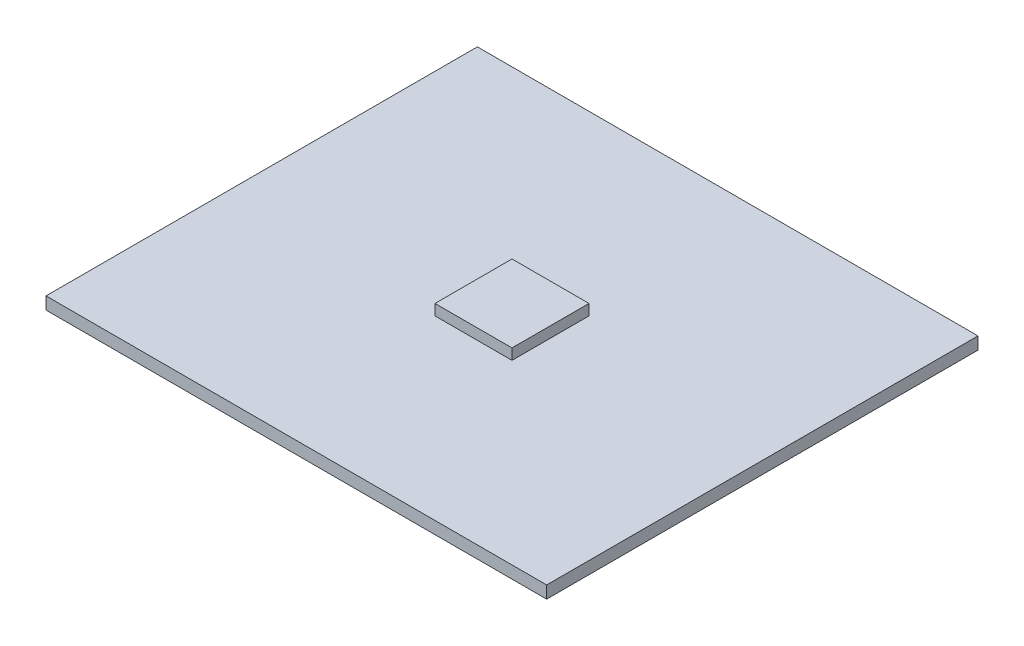
from build123d import *

# Parameters (mm, degrees)
SKETCH1_W           = 65
SKETCH1_H           = 56
BOSS_EXTRUDE1_DEPTH = 1.6
SKETCH2_W           = 10
SKETCH2_H           = 10
BOSS_EXTRUDE2_DEPTH = 3


with BuildPart() as part:
    # Sketch1 → Boss-Extrude1 (new body)
    with BuildSketch(Plane(origin=(0, 0, 0), x_dir=(1, 0, 0), z_dir=(0, 1, 0))):
        Rectangle(SKETCH1_W, SKETCH1_H)
    extrude(amount=BOSS_EXTRUDE1_DEPTH)

    # Sketch2 → Boss-Extrude2 (add)
    with BuildSketch(Plane(origin=(0, 0, 0), x_dir=(1, 0, 0), z_dir=(0, 1, 0))):
        Rectangle(SKETCH2_W, SKETCH2_H)
    extrude(amount=BOSS_EXTRUDE2_DEPTH)


solid = part.part
